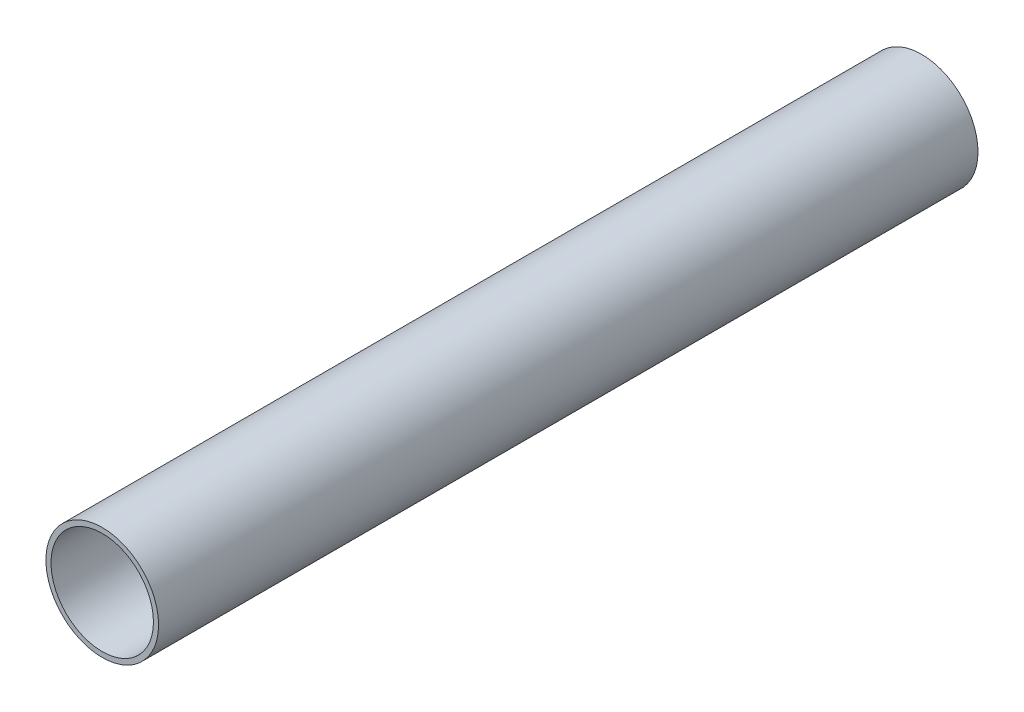
from build123d import *

# Parameters (mm, degrees)
SKETCH2_R           = 5.5
SKETCH2_R_2         = 5
BOSS_EXTRUDE2_DEPTH = 80


with BuildPart() as part:
    # Sketch2 → Boss-Extrude2 (new body)
    with BuildSketch(Plane.XY):
        Circle(SKETCH2_R)
        Circle(SKETCH2_R_2, mode=Mode.SUBTRACT)
    extrude(amount=BOSS_EXTRUDE2_DEPTH)


solid = part.part
